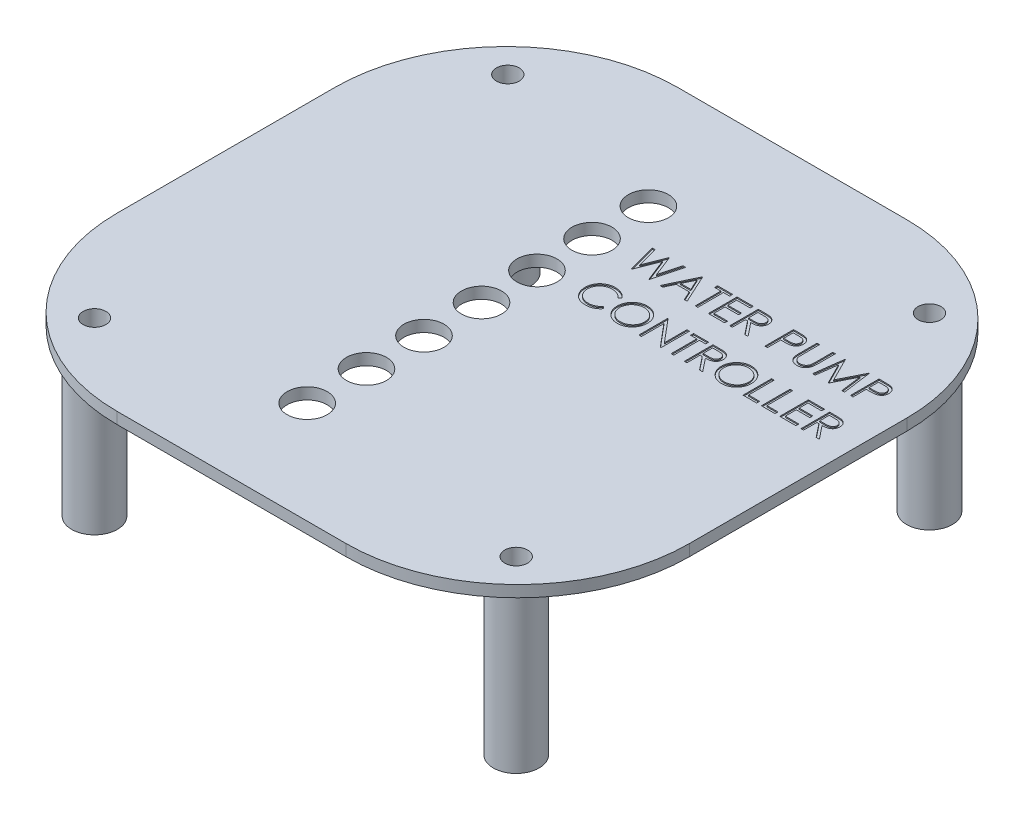
from build123d import *

# Parameters (mm, degrees)
SKETCH1_R                = 4
BOSS_EXTRUDE1_DEPTH      = 2
SKETCH5_R                = 3.5
CUT_EXTRUDE1_DEPTH       = 10
CUT_EXTRUDE2_DEPTH       = 0.2
BOSS_EXTRUDE2_DEPTH      = 2
BOSS_EXTRUDE2_DEPTH_BACK = 28
SKETCH1_6_R              = 4
SKETCH1_6_R_2            = 1.2
CUT_EXTRUDE3_DEPTH       = 3
CUT_EXTRUDE3_DEPTH_BACK  = 26
SKETCH1_7_R              = 2


with BuildPart() as part:
    # Sketch1 → Boss-Extrude1 (new body)
    with BuildSketch(Plane(origin=(0, 0, 0), x_dir=(1, 0, 0), z_dir=(0, 1, 0))):
        with BuildLine():
            Line((-20, -49), (20, -49))
            ThreePointArc((20, -49), (41.213203436, -40.213203436), (50, -19))
            Line((50, -19), (50, 19))
            ThreePointArc((50, 19), (41.213203436, 40.213203436), (20, 49))
            Line((20, 49), (-20, 49))
            ThreePointArc((-20, 49), (-41.213203436, 40.213203436), (-50, 19))
            Line((-50, 19), (-50, -19))
            ThreePointArc((-50, -19), (-41.213203436, -40.213203436), (-20, -49))
        make_face()
        with Locations(Location((-36.843325024, 36.106458524, 0), (0, 0, 270))):
            Circle(SKETCH1_R, mode=Mode.SUBTRACT)
        with Locations(Location((36.106458524, 36.843325024, 0), (0, 0, 270))):
            Circle(SKETCH1_R, mode=Mode.SUBTRACT)
        with Locations(Location((-36.106458524, -36.843325024, 0), (0, 0, 270))):
            Circle(SKETCH1_R, mode=Mode.SUBTRACT)
        with Locations(Location((36.843325024, -36.106458524, 0), (0, 0, 270))):
            Circle(SKETCH1_R, mode=Mode.SUBTRACT)
    extrude(amount=BOSS_EXTRUDE1_DEPTH)

    # Sketch5 → Cut-Extrude1 (cut)
    with BuildSketch(Plane(origin=(0, 0, 0), x_dir=(1, 0, 0), z_dir=(0, 1, 0))):
        with Locations(Location((-4.63917207, 28.478571343, 0), (0, 0, 270))):
            Circle(SKETCH5_R)
        with Locations(Location((-4.63917207, 18.621872332, 0), (0, 0, 270))):
            Circle(SKETCH5_R)
        with Locations(Location((-4.63917207, 9.004273886, 0), (0, 0, 270))):
            Circle(SKETCH5_R)
        with Locations(Location((-4.63917207, -0.687992807, 0), (0, 0, 270))):
            Circle(SKETCH5_R)
        with Locations(Location((-4.63917207, -10.737546261, 0), (0, 0, 270))):
            Circle(SKETCH5_R)
        with Locations(Location((-4.63917207, -20.789699287, 0), (0, 0, 270))):
            Circle(SKETCH5_R)
        with Locations(Location((-4.63917207, -31.146834905, 0), (0, 0, 270))):
            Circle(SKETCH5_R)
    extrude(amount=CUT_EXTRUDE1_DEPTH, mode=Mode.SUBTRACT)

    # Sketch7 → Cut-Extrude2 (cut)
    # profile 1 of 19: a face of its own
    with BuildSketch(Plane(origin=(0, 2, 0), x_dir=(1, 0, 0), z_dir=(0, 1, 0))):
        Polygon((2.04459951, 22.472075069), (2.508341497, 22.472075069), (3.486907202, 18.805208081), (4.942235728, 22.472075069), (5.007339894, 22.472075069), (6.435625151, 18.830248145), (7.419198869, 22.472075069), (7.877932843, 22.472075069), (6.529775792, 17.472075069), (6.465673228, 17.472075069), (4.961266176, 21.296193658), (3.438830279, 17.472075069), (3.374727715, 17.472075069), align=None)
    # profile 2 of 19: a face of its own
    with BuildSketch(Plane(origin=(0, 2, 0), x_dir=(1, 0, 0), z_dir=(0, 1, 0))):
        Polygon((10.826650792, 22.472075069), (13.134343099, 17.472075069), (12.646562651, 17.472075069), (11.907379958, 19.074639171), (9.640753356, 19.074639171), (8.88053701, 17.472075069), (8.390753356, 17.472075069), (10.762548228, 22.472075069), align=None)
        Polygon((10.789591497, 21.497515774), (9.884142779, 19.587459684), (11.671001753, 19.587459684), align=None, mode=Mode.SUBTRACT)
    # profile 3 of 19: a face of its own
    with BuildSketch(Plane(origin=(0, 2, 0), x_dir=(1, 0, 0), z_dir=(0, 1, 0))):
        Polygon((13.45485592, 21.959254556), (13.45485592, 22.472075069), (16.083061048, 22.472075069), (16.083061048, 21.959254556), (14.993317458, 21.959254556), (14.993317458, 17.472075069), (14.54459951, 17.472075069), (14.54459951, 21.959254556), align=None)
    # profile 4 of 19: a face of its own
    with BuildSketch(Plane(origin=(0, 2, 0), x_dir=(1, 0, 0), z_dir=(0, 1, 0))):
        Polygon((16.852291817, 22.472075069), (19.672804638, 22.472075069), (19.672804638, 21.959254556), (17.301009766, 21.959254556), (17.301009766, 20.420793017), (19.672804638, 20.420793017), (19.672804638, 19.907972504), (17.301009766, 19.907972504), (17.301009766, 17.984895581), (19.672804638, 17.984895581), (19.672804638, 17.472075069), (16.852291817, 17.472075069), align=None)
    # profile 5 of 19: a face of its own
    with BuildSketch(Plane(origin=(0, 2, 0), x_dir=(1, 0, 0), z_dir=(0, 1, 0))):
        with BuildLine():
            Line((20.570240535, 22.472075069), (21.570841497, 22.472075069))
            add(Edge.make_bspline(
                [(21.570841497, 22.472075069), (21.637614538, 22.471852803), (21.765826172, 22.471426028), (21.949502273, 22.469046367), (22.116398126, 22.462225859), (22.266426468, 22.456356454), (22.399584546, 22.44565368), (22.516280676, 22.435424184), (22.615977387, 22.42203324), (22.676328603, 22.409596922), (22.703653997, 22.403966094)],
                knots=[0, 0, 0, 0, 1.410062039, 2.707475311, 3.878576406, 4.937260626, 5.877586885, 6.699081471, 7.410979367, 8, 8, 8, 8], degree=3))
            add(Edge.make_bspline(
                [(22.703653997, 22.403966094), (22.740234888, 22.394927858), (22.812616302, 22.377044196), (22.916830682, 22.339244766), (23.016136859, 22.295502445), (23.110122322, 22.244125702), (23.19831631, 22.184733159), (23.281628182, 22.118350127), (23.360435987, 22.045339833), (23.431552602, 21.963861488), (23.49860839, 21.87838076), (23.555163571, 21.785946822), (23.603915685, 21.689287497), (23.642730709, 21.587419757), (23.673984957, 21.481331512), (23.696022441, 21.370061802), (23.709238424, 21.254117552), (23.710583932, 21.175034825), (23.711266176, 21.134935645)],
                knots=[0, 0, 0, 0, 1.027469482, 2.033020251, 3.019912614, 3.986113645, 4.951240523, 5.91722682, 6.890402269, 7.87763091, 8.8651537, 9.85103654, 10.82876324, 11.815024772, 12.821070561, 13.842952187, 14.906261191, 16, 16, 16, 16], degree=3))
            add(Edge.make_bspline(
                [(23.711266176, 21.134935645), (23.709167608, 21.068314067), (23.705072756, 20.938318113), (23.666894037, 20.749659711), (23.604356152, 20.573674976), (23.518180024, 20.410585493), (23.408437916, 20.263570286), (23.276545358, 20.134441064), (23.12242877, 20.026384046), (22.978958318, 19.951451468), (22.852223747, 19.903461598), (22.747890443, 19.869695371), (22.634080476, 19.843606849), (22.511884283, 19.820235233), (22.380793347, 19.802589955), (22.241121862, 19.789666249), (22.092770217, 19.781589036), (21.990857261, 19.780386172), (21.938429638, 19.779767376)],
                knots=[0, 0, 0, 0, 1.260483769, 2.459530307, 3.627416485, 4.787058657, 5.939039949, 7.08810263, 8.267026773, 9.491475466, 10.141966685, 10.831826277, 11.566392101, 12.351337768, 13.187381173, 14.07005841, 15.007169909, 16, 16, 16, 16], degree=3))
            Line((21.938429638, 19.779767376), (23.77536874, 17.472075069))
            Line((23.77536874, 17.472075069), (23.22048092, 17.472075069))
            Line((23.22048092, 17.472075069), (21.383541817, 19.779767376))
            Line((21.383541817, 19.779767376), (21.018958484, 19.779767376))
            Line((21.018958484, 19.779767376), (21.018958484, 17.472075069))
            Line((21.018958484, 17.472075069), (20.570240535, 17.472075069))
            Line((20.570240535, 17.472075069), (20.570240535, 22.472075069))
        make_face()
        with BuildLine():
            Line((21.018958484, 21.959254556), (21.018958484, 20.292587889))
            Line((21.018958484, 20.292587889), (21.934423228, 20.285576671))
            add(Edge.make_bspline(
                [(21.934423228, 20.285576671), (21.97716614, 20.285557762), (22.060014079, 20.28552111), (22.179872172, 20.291226504), (22.291472331, 20.297716959), (22.394387691, 20.307644595), (22.488664228, 20.320438983), (22.574254818, 20.336443247), (22.651299178, 20.35508905), (22.741154233, 20.383948516), (22.841492135, 20.429671399), (22.950537077, 20.49619354), (23.04339756, 20.57986371), (23.121851649, 20.675540076), (23.184893694, 20.780734717), (23.229339486, 20.894186673), (23.257542975, 21.013031813), (23.260869468, 21.094714825), (23.262548228, 21.135937248)],
                knots=[0, 0, 0, 0, 1.146690395, 2.22261258, 3.21895312, 4.145990853, 4.996080663, 5.770904154, 6.481378293, 7.121626537, 8.300444488, 9.431385265, 10.535395872, 11.636531494, 12.74115979, 13.810798291, 14.895190096, 16, 16, 16, 16], degree=3))
            add(Edge.make_bspline(
                [(23.262548228, 21.135937248), (23.260830912, 21.176146639), (23.257427818, 21.25582698), (23.229643863, 21.37247828), (23.182659033, 21.482573923), (23.11934155, 21.585666045), (23.0421999, 21.679245668), (22.951745882, 21.759313029), (22.850452746, 21.825383693), (22.755779606, 21.867604236), (22.671159302, 21.893489741), (22.597688359, 21.911705689), (22.514671962, 21.926340645), (22.421707021, 21.938066446), (22.319190406, 21.948144938), (22.206603762, 21.954933193), (22.084694076, 21.958952999), (22.00019846, 21.959151698), (21.956458484, 21.959254556)],
                knots=[0, 0, 0, 0, 1.101028733, 2.181837193, 3.264309656, 4.369019818, 5.486613113, 6.575447106, 7.666700264, 8.788928104, 9.402425223, 10.0903467, 10.862060571, 11.710948788, 12.657782767, 13.684531032, 14.801375019, 16, 16, 16, 16], degree=3))
            Line((21.956458484, 21.959254556), (21.018958484, 21.959254556))
        make_face(mode=Mode.SUBTRACT)
    # profile 6 of 19: a face of its own
    with BuildSketch(Plane(origin=(0, 2, 0), x_dir=(1, 0, 0), z_dir=(0, 1, 0))):
        with BuildLine():
            Line((26.724086689, 22.472075069), (27.704655599, 22.472075069))
            add(Edge.make_bspline(
                [(27.704655599, 22.472075069), (27.772099751, 22.472000931), (27.901325741, 22.47185888), (28.086632963, 22.467552101), (28.25493258, 22.461799683), (28.405861695, 22.45382555), (28.539884693, 22.44440185), (28.656395121, 22.431184651), (28.756308773, 22.417384228), (28.816175129, 22.403353648), (28.843477715, 22.396954876)],
                knots=[0, 0, 0, 0, 1.415646017, 2.712440637, 3.8905458, 4.950247383, 5.884950622, 6.709939814, 7.411656543, 8, 8, 8, 8], degree=3))
            add(Edge.make_bspline(
                [(28.843477715, 22.396954876), (28.878039906, 22.387494948), (28.946349873, 22.368798003), (29.044779935, 22.331349826), (29.138428286, 22.286946733), (29.227616226, 22.236341105), (29.311247773, 22.177361727), (29.390570689, 22.112399416), (29.464884947, 22.039954318), (29.533772649, 21.960838976), (29.597036646, 21.876381533), (29.651507621, 21.785321205), (29.697117946, 21.689190771), (29.736236905, 21.588057098), (29.76439184, 21.481070922), (29.785601697, 21.368975618), (29.799064022, 21.251783204), (29.800353396, 21.171697679), (29.801009766, 21.130929235)],
                knots=[0, 0, 0, 0, 0.999701418, 1.975846123, 2.934577507, 3.890451536, 4.834027766, 5.787354733, 6.749476667, 7.726910423, 8.712836071, 9.690891519, 10.682875813, 11.679750201, 12.712814741, 13.765529915, 14.8625177, 16, 16, 16, 16], degree=3))
            add(Edge.make_bspline(
                [(29.801009766, 21.130929235), (29.800407731, 21.089818125), (29.799229808, 21.009381463), (29.785092257, 20.891706051), (29.766049127, 20.779251208), (29.736767623, 20.672266279), (29.698416662, 20.571386607), (29.653428015, 20.475070561), (29.599165829, 20.384956744), (29.536816072, 20.300718005), (29.467456651, 20.222275273), (29.391381025, 20.150196995), (29.308896322, 20.084905083), (29.220264682, 20.026253163), (29.12462204, 19.975601335), (29.023418964, 19.930233757), (28.915775798, 19.892132242), (28.841286492, 19.872089297), (28.803413612, 19.861898786)],
                knots=[0, 0, 0, 0, 1.121902311, 2.195077645, 3.232258892, 4.234102512, 5.217864754, 6.176164875, 7.132989551, 8.084763148, 9.034132444, 9.988522005, 10.94243251, 11.903244335, 12.886203696, 13.894208494, 14.929344452, 16, 16, 16, 16], degree=3))
            add(Edge.make_bspline(
                [(28.803413612, 19.861898786), (28.772088849, 19.855237385), (28.70343881, 19.840638536), (28.590377779, 19.824340741), (28.458741513, 19.810429883), (28.308709685, 19.799999686), (28.140416963, 19.791070588), (27.95377231, 19.783973311), (27.748409342, 19.78007352), (27.605164708, 19.779872387), (27.530376753, 19.779767376)],
                knots=[0, 0, 0, 0, 0.601384939, 1.31797006, 2.144135048, 3.087295005, 4.142315834, 5.309527816, 6.595305764, 8, 8, 8, 8], degree=3))
            Line((27.530376753, 19.779767376), (27.172804638, 19.779767376))
            Line((27.172804638, 19.779767376), (27.172804638, 17.472075069))
            Line((27.172804638, 17.472075069), (26.724086689, 17.472075069))
            Line((26.724086689, 17.472075069), (26.724086689, 22.472075069))
        make_face()
        with BuildLine():
            Line((27.172804638, 21.959254556), (27.172804638, 20.292587889))
            Line((27.172804638, 20.292587889), (28.048205279, 20.281570261))
            add(Edge.make_bspline(
                [(28.048205279, 20.281570261), (28.09094803, 20.28154817), (28.17346203, 20.281505524), (28.292656635, 20.2871987), (28.403241331, 20.29377089), (28.504876438, 20.303393638), (28.597607773, 20.316995434), (28.681589957, 20.330726488), (28.75617179, 20.350591292), (28.843456364, 20.377338534), (28.940718289, 20.422956556), (29.046529073, 20.489170685), (29.136201339, 20.573571696), (29.213798906, 20.668468598), (29.275378731, 20.774038783), (29.32045872, 20.886994407), (29.346946088, 21.006177049), (29.350497793, 21.087731533), (29.352291817, 21.12892603)],
                knots=[0, 0, 0, 0, 1.160613943, 2.240541288, 3.23993089, 4.169200891, 5.011653406, 5.7853311, 6.478053781, 7.106038997, 8.262395093, 9.384106736, 10.481365981, 11.59014053, 12.70357646, 13.786202915, 14.881775077, 16, 16, 16, 16], degree=3))
            add(Edge.make_bspline(
                [(29.352291817, 21.12892603), (29.350488037, 21.169123906), (29.346902344, 21.249032309), (29.320251111, 21.366144825), (29.275466377, 21.477910117), (29.213385527, 21.582157381), (29.138041056, 21.676712816), (29.050470566, 21.758851569), (28.950880192, 21.824882572), (28.858239862, 21.867501546), (28.775952454, 21.893523368), (28.704478225, 21.911730283), (28.623777262, 21.926266864), (28.533823291, 21.938037582), (28.435313528, 21.948113955), (28.32740165, 21.954951065), (28.210496445, 21.958953146), (28.129338487, 21.959151653), (28.087267779, 21.959254556)],
                knots=[0, 0, 0, 0, 1.120700087, 2.227813068, 3.331159281, 4.466773991, 5.599788987, 6.693661531, 7.80175334, 8.91857717, 9.525282508, 10.207424825, 10.974604443, 11.810962634, 12.737642355, 13.736264703, 14.826523623, 16, 16, 16, 16], degree=3))
            Line((28.087267779, 21.959254556), (27.172804638, 21.959254556))
        make_face(mode=Mode.SUBTRACT)
    # profile 7 of 19: a face of its own
    with BuildSketch(Plane(origin=(0, 2, 0), x_dir=(1, 0, 0), z_dir=(0, 1, 0))):
        with BuildLine():
            Line((30.826650792, 22.472075069), (31.27536874, 22.472075069))
            Line((31.27536874, 22.472075069), (31.27536874, 19.476281799))
            add(Edge.make_bspline(
                [(31.27536874, 19.476281799), (31.275301963, 19.433880748), (31.275175242, 19.353417447), (31.276021691, 19.238891303), (31.278392217, 19.137073505), (31.279886731, 19.047571579), (31.283211493, 18.970796226), (31.285922988, 18.906331496), (31.289409498, 18.854482636), (31.293599666, 18.82422417), (31.295400792, 18.811217697)],
                knots=[0, 0, 0, 0, 1.528628734, 2.90083645, 4.128790002, 5.200304208, 6.127813768, 6.898992206, 7.526736466, 8, 8, 8, 8], degree=3))
            add(Edge.make_bspline(
                [(31.295400792, 18.811217697), (31.302797161, 18.764293749), (31.317173142, 18.67308985), (31.353810824, 18.543220876), (31.404978683, 18.426175936), (31.465611601, 18.318302663), (31.545515332, 18.222603577), (31.641234668, 18.134444073), (31.757202909, 18.057341495), (31.886146631, 17.986840335), (32.025125542, 17.930175932), (32.167141636, 17.887328269), (32.310060178, 17.861215555), (32.405740414, 17.858191927), (32.453253356, 17.856690453)],
                knots=[0, 0, 0, 0, 1.035780045, 2.013197591, 2.933192213, 3.817615948, 4.702609284, 5.640816605, 6.646850145, 7.73207398, 8.84249596, 9.914020372, 10.964143139, 12, 12, 12, 12], degree=3))
            add(Edge.make_bspline(
                [(32.453253356, 17.856690453), (32.494044413, 17.858224525), (32.57539093, 17.861283808), (32.69625726, 17.88022871), (32.813971701, 17.914372375), (32.929115529, 17.958429173), (33.037045507, 18.016640017), (33.137821853, 18.083884073), (33.22777033, 18.162756754), (33.309853184, 18.25004296), (33.381331664, 18.348528389), (33.443290438, 18.456068586), (33.494041766, 18.574281938), (33.519103944, 18.657359684), (33.531979317, 18.700039812)],
                knots=[0, 0, 0, 0, 0.994687771, 1.983630487, 2.973142513, 3.978332533, 4.983357753, 5.956394766, 6.925816176, 7.893390482, 8.871859704, 9.88551698, 10.913711441, 12, 12, 12, 12], degree=3))
            add(Edge.make_bspline(
                [(33.531979317, 18.700039812), (33.536265211, 18.717680633), (33.545815908, 18.75699149), (33.554740258, 18.823450476), (33.564035294, 18.901863853), (33.57048468, 18.992795015), (33.576772138, 19.095939261), (33.58053367, 19.211833915), (33.582272289, 19.340058144), (33.582790404, 19.429539804), (33.583061048, 19.476281799)],
                knots=[0, 0, 0, 0, 0.558680831, 1.244966039, 2.062412453, 2.990489873, 4.051219941, 5.244515665, 6.560634259, 8, 8, 8, 8], degree=3))
            Line((33.583061048, 19.476281799), (33.583061048, 22.472075069))
            Line((33.583061048, 22.472075069), (34.031778997, 22.472075069))
            Line((34.031778997, 22.472075069), (34.031778997, 19.452243338))
            add(Edge.make_bspline(
                [(34.031778997, 19.452243338), (34.031415968, 19.397817082), (34.030707494, 19.291600935), (34.024563814, 19.135956136), (34.0147681, 18.98830902), (34.000927974, 18.84863974), (33.982589398, 18.717448084), (33.962196226, 18.593584129), (33.936225464, 18.477936997), (33.905892034, 18.369604971), (33.871215537, 18.266482809), (33.826299611, 18.16861336), (33.775693182, 18.07302136), (33.715672249, 17.981152633), (33.648227417, 17.892600415), (33.571867873, 17.807901736), (33.489119072, 17.725703099), (33.398605415, 17.648113004), (33.301818951, 17.576957751), (33.199047582, 17.514389507), (33.091080769, 17.461498625), (32.97819916, 17.41796159), (32.860354584, 17.385226448), (32.73754407, 17.360833369), (32.60948808, 17.346972944), (32.522395714, 17.344913043), (32.47829342, 17.34386994)],
                knots=[0, 0, 0, 0, 1.316592851, 2.569410997, 3.76748051, 4.895814652, 5.963796859, 6.97159953, 7.931736103, 8.829262218, 9.692595152, 10.560224239, 11.431080259, 12.30701507, 13.211635791, 14.121146779, 15.063487852, 16.031507147, 17.00238618, 17.966455255, 18.938106653, 19.907068911, 20.888905087, 21.893141452, 22.933117798, 24, 24, 24, 24], degree=3))
            add(Edge.make_bspline(
                [(32.47829342, 17.34386994), (32.430194702, 17.344991034), (32.335825189, 17.347190614), (32.196770807, 17.359794543), (32.063464813, 17.383535107), (31.934499274, 17.413763598), (31.811629992, 17.455454651), (31.693210786, 17.504166258), (31.581269813, 17.563990915), (31.473991058, 17.630552905), (31.374241406, 17.705445246), (31.282673688, 17.787074065), (31.19913673, 17.874131747), (31.125038592, 17.967560841), (31.059151614, 18.066634709), (31.002394166, 18.171633623), (30.95366096, 18.282516931), (30.928508722, 18.359592932), (30.91579342, 18.39855744)],
                knots=[0, 0, 0, 0, 1.13879206, 2.234305948, 3.301075583, 4.341971843, 5.366689343, 6.369221514, 7.369726634, 8.367512178, 9.355451585, 10.318319045, 11.268648973, 12.207971039, 13.137398894, 14.081662264, 15.030215811, 16, 16, 16, 16], degree=3))
            add(Edge.make_bspline(
                [(30.91579342, 18.39855744), (30.90839748, 18.425175404), (30.892355521, 18.482910359), (30.875176524, 18.578462486), (30.860734979, 18.688483797), (30.84715561, 18.812981823), (30.839142813, 18.952053061), (30.8321179, 19.105637227), (30.826601302, 19.273920029), (30.826633834, 19.391140766), (30.826650792, 19.452243338)],
                knots=[0, 0, 0, 0, 0.625038921, 1.35572334, 2.194682327, 3.136881307, 4.189498639, 5.346923369, 6.617055217, 8, 8, 8, 8], degree=3))
            Line((30.826650792, 19.452243338), (30.826650792, 22.472075069))
        make_face()
    # profile 8 of 19: a face of its own
    with BuildSketch(Plane(origin=(0, 2, 0), x_dir=(1, 0, 0), z_dir=(0, 1, 0))):
        Polygon((35.057420022, 17.472075069), (35.717476112, 22.472075069), (35.781578676, 22.472075069), (37.845881561, 18.369510966), (39.905176433, 22.472075069), (39.970280599, 22.472075069), (40.634343099, 17.472075069), (40.183621946, 17.472075069), (39.70485592, 21.069831479), (37.899968099, 17.472075069), (37.79880624, 17.472075069), (35.986907202, 21.077844299), (35.509142779, 17.472075069), align=None)
    # profile 9 of 19: a face of its own
    with BuildSketch(Plane(origin=(0, 2, 0), x_dir=(1, 0, 0), z_dir=(0, 1, 0))):
        with BuildLine():
            Line((41.659984125, 22.472075069), (42.640553035, 22.472075069))
            add(Edge.make_bspline(
                [(42.640553035, 22.472075069), (42.707997187, 22.472000931), (42.837223177, 22.47185888), (43.022530399, 22.467552101), (43.190830016, 22.461799683), (43.341759131, 22.45382555), (43.475782129, 22.44440185), (43.592292557, 22.431184651), (43.692206208, 22.417384228), (43.752072565, 22.403353648), (43.779375151, 22.396954876)],
                knots=[0, 0, 0, 0, 1.415646017, 2.712440637, 3.8905458, 4.950247383, 5.884950622, 6.709939814, 7.411656543, 8, 8, 8, 8], degree=3))
            add(Edge.make_bspline(
                [(43.779375151, 22.396954876), (43.813937342, 22.387494948), (43.882247309, 22.368798003), (43.980677371, 22.331349826), (44.074325721, 22.286946733), (44.163513662, 22.236341105), (44.247145209, 22.177361727), (44.326468125, 22.112399416), (44.400782383, 22.039954318), (44.469670085, 21.960838976), (44.532934082, 21.876381533), (44.587405057, 21.785321205), (44.633015381, 21.689190771), (44.672134341, 21.588057098), (44.700289276, 21.481070922), (44.721499132, 21.368975618), (44.734961458, 21.251783204), (44.736250832, 21.171697679), (44.736907202, 21.130929235)],
                knots=[0, 0, 0, 0, 0.999701418, 1.975846123, 2.934577507, 3.890451536, 4.834027766, 5.787354733, 6.749476667, 7.726910423, 8.712836071, 9.690891519, 10.682875813, 11.679750201, 12.712814741, 13.765529915, 14.8625177, 16, 16, 16, 16], degree=3))
            add(Edge.make_bspline(
                [(44.736907202, 21.130929235), (44.736305167, 21.089818125), (44.735127244, 21.009381463), (44.720989693, 20.891706051), (44.701946562, 20.779251208), (44.672665059, 20.672266279), (44.634314098, 20.571386607), (44.589325451, 20.475070561), (44.535063264, 20.384956744), (44.472713508, 20.300718005), (44.403354087, 20.222275273), (44.327278461, 20.150196995), (44.244793758, 20.084905083), (44.156162118, 20.026253163), (44.060519476, 19.975601335), (43.9593164, 19.930233757), (43.851673233, 19.892132242), (43.777183928, 19.872089297), (43.739311048, 19.861898786)],
                knots=[0, 0, 0, 0, 1.121902311, 2.195077645, 3.232258892, 4.234102512, 5.217864754, 6.176164875, 7.132989551, 8.084763148, 9.034132444, 9.988522005, 10.94243251, 11.903244335, 12.886203696, 13.894208494, 14.929344452, 16, 16, 16, 16], degree=3))
            add(Edge.make_bspline(
                [(43.739311048, 19.861898786), (43.707986285, 19.855237385), (43.639336246, 19.840638536), (43.526275214, 19.824340741), (43.394638949, 19.810429883), (43.24460712, 19.799999686), (43.076314399, 19.791070588), (42.889669746, 19.783973311), (42.684306778, 19.78007352), (42.541062144, 19.779872387), (42.466274189, 19.779767376)],
                knots=[0, 0, 0, 0, 0.601384939, 1.31797006, 2.144135048, 3.087295005, 4.142315834, 5.309527816, 6.595305764, 8, 8, 8, 8], degree=3))
            Line((42.466274189, 19.779767376), (42.108702074, 19.779767376))
            Line((42.108702074, 19.779767376), (42.108702074, 17.472075069))
            Line((42.108702074, 17.472075069), (41.659984125, 17.472075069))
            Line((41.659984125, 17.472075069), (41.659984125, 22.472075069))
        make_face()
        with BuildLine():
            Line((42.108702074, 21.959254556), (42.108702074, 20.292587889))
            Line((42.108702074, 20.292587889), (42.984102715, 20.281570261))
            add(Edge.make_bspline(
                [(42.984102715, 20.281570261), (43.026845466, 20.28154817), (43.109359466, 20.281505524), (43.22855407, 20.2871987), (43.339138767, 20.29377089), (43.440773874, 20.303393638), (43.533505209, 20.316995434), (43.617487393, 20.330726488), (43.692069226, 20.350591292), (43.7793538, 20.377338534), (43.876615725, 20.422956556), (43.982426509, 20.489170685), (44.072098775, 20.573571696), (44.149696342, 20.668468598), (44.211276167, 20.774038783), (44.256356156, 20.886994407), (44.282843524, 21.006177049), (44.286395229, 21.087731533), (44.288189253, 21.12892603)],
                knots=[0, 0, 0, 0, 1.160613943, 2.240541288, 3.23993089, 4.169200891, 5.011653406, 5.7853311, 6.478053781, 7.106038997, 8.262395093, 9.384106736, 10.481365981, 11.59014053, 12.70357646, 13.786202915, 14.881775077, 16, 16, 16, 16], degree=3))
            add(Edge.make_bspline(
                [(44.288189253, 21.12892603), (44.286385473, 21.169123906), (44.28279978, 21.249032309), (44.256148547, 21.366144825), (44.211363813, 21.477910117), (44.149282963, 21.582157381), (44.073938492, 21.676712816), (43.986368002, 21.758851569), (43.886777628, 21.824882572), (43.794137298, 21.867501546), (43.71184989, 21.893523368), (43.640375661, 21.911730283), (43.559674698, 21.926266864), (43.469720727, 21.938037582), (43.371210964, 21.948113955), (43.263299086, 21.954951065), (43.146393881, 21.958953146), (43.065235923, 21.959151653), (43.023165215, 21.959254556)],
                knots=[0, 0, 0, 0, 1.120700087, 2.227813068, 3.331159281, 4.466773991, 5.599788987, 6.693661531, 7.80175334, 8.91857717, 9.525282508, 10.207424825, 10.974604443, 11.810962634, 12.737642355, 13.736264703, 14.826523623, 16, 16, 16, 16], degree=3))
            Line((43.023165215, 21.959254556), (42.108702074, 21.959254556))
        make_face(mode=Mode.SUBTRACT)
    # profile 10 of 19: a face of its own
    with BuildSketch(Plane(origin=(0, 2, 0), x_dir=(1, 0, 0), z_dir=(0, 1, 0))):
        with BuildLine():
            Line((6.980496946, 12.221273786), (6.58786874, 11.920793017))
            add(Edge.make_bspline(
                [(6.58786874, 11.920793017), (6.559860328, 11.954172974), (6.504221119, 12.020482854), (6.414707972, 12.113596489), (6.321419911, 12.200832576), (6.224392595, 12.28260669), (6.121879567, 12.356059213), (6.01636414, 12.425017931), (5.906081219, 12.486828985), (5.753578741, 12.561776108), (5.554081815, 12.639984901), (5.30294633, 12.705560946), (5.040787618, 12.747305483), (4.861933904, 12.751826685), (4.770961689, 12.754126351)],
                knots=[0, 0, 0, 0, 0.757959112, 1.505699292, 2.245454638, 2.979532153, 3.711538275, 4.438200793, 5.171680507, 5.909471876, 7.393775596, 8.890124382, 10.418191784, 12, 12, 12, 12], degree=3))
            add(Edge.make_bspline(
                [(4.770961689, 12.754126351), (4.72084269, 12.753549261), (4.621069844, 12.752400439), (4.473000596, 12.737244545), (4.327696237, 12.715942817), (4.185251285, 12.684335212), (4.045847059, 12.644374328), (3.908572199, 12.596623736), (3.775414199, 12.537545394), (3.644531001, 12.47224788), (3.519132129, 12.398494387), (3.40048206, 12.318046742), (3.289013535, 12.231805175), (3.184638375, 12.139446452), (3.087249877, 12.041386508), (2.997553719, 11.936580306), (2.915860275, 11.825362915), (2.84055024, 11.709200904), (2.773103478, 11.588432631), (2.716632221, 11.462611102), (2.666624904, 11.333890954), (2.627054557, 11.200817867), (2.595733819, 11.064328202), (2.574122871, 10.924055648), (2.559139341, 10.780293248), (2.557996231, 10.682851373), (2.557420022, 10.633733722)],
                knots=[0, 0, 0, 0, 1.054917814, 2.100044995, 3.131103042, 4.146048494, 5.169673617, 6.183595914, 7.203665975, 8.234915748, 9.262203917, 10.264457458, 11.251630812, 12.227803204, 13.197192746, 14.159520551, 15.12972552, 16.100847026, 17.073214652, 18.039054194, 19.002613845, 19.979014051, 20.95965708, 21.949030935, 22.966165397, 24, 24, 24, 24], degree=3))
            add(Edge.make_bspline(
                [(2.557420022, 10.633733722), (2.559222621, 10.559831837), (2.562761784, 10.414735287), (2.594259404, 10.202205843), (2.642123821, 9.998604881), (2.713860359, 9.805205106), (2.802316146, 9.619621737), (2.914088448, 9.444994804), (3.043540644, 9.278685426), (3.1925041, 9.124624072), (3.35594098, 8.983890179), (3.53129514, 8.859960777), (3.718129837, 8.756653802), (3.914382165, 8.670688164), (4.121562328, 8.604607124), (4.33929776, 8.558086948), (4.567114896, 8.527740976), (4.722785467, 8.524835707), (4.802011369, 8.52335712)],
                knots=[0, 0, 0, 0, 1.029171465, 2.020641659, 2.987623507, 3.938342917, 4.889210282, 5.84687017, 6.821220943, 7.821438502, 8.827599549, 9.822697543, 10.807740252, 11.797342354, 12.80366471, 13.83203677, 14.896651826, 16, 16, 16, 16], degree=3))
            add(Edge.make_bspline(
                [(4.802011369, 8.52335712), (4.889300924, 8.525769662), (5.061107651, 8.530518123), (5.313061975, 8.570745622), (5.554255926, 8.635971219), (5.784702478, 8.727253965), (6.003751972, 8.845918662), (6.211747201, 8.989772772), (6.408863731, 9.160184676), (6.527394134, 9.290303431), (6.58786874, 9.356690453)],
                knots=[0, 0, 0, 0, 1.028121516, 2.023589091, 2.998037872, 3.967518031, 4.937445131, 5.927275754, 6.942489185, 8, 8, 8, 8], degree=3))
            Line((6.58786874, 9.356690453), (6.980496946, 9.059214492))
            add(Edge.make_bspline(
                [(6.980496946, 9.059214492), (6.948899646, 9.018445275), (6.885856395, 8.937102123), (6.783773514, 8.822428252), (6.676234518, 8.714565344), (6.562440646, 8.614383028), (6.443700944, 8.519876648), (6.317883355, 8.433731175), (6.18664188, 8.354744198), (6.050421196, 8.28242002), (5.909366035, 8.218252524), (5.763645413, 8.16331857), (5.613887448, 8.115997299), (5.460085293, 8.077065961), (5.301919926, 8.046678698), (5.139962106, 8.026364877), (4.973862285, 8.012447857), (4.861803112, 8.011179405), (4.805016176, 8.010536607)],
                knots=[0, 0, 0, 0, 0.986787822, 1.968848986, 2.935600012, 3.899624008, 4.868462664, 5.837806735, 6.815139263, 7.798259679, 8.787526145, 9.778297419, 10.776456485, 11.791383307, 12.812564526, 13.85620153, 14.913611965, 16, 16, 16, 16], degree=3))
            add(Edge.make_bspline(
                [(4.805016176, 8.010536607), (4.751239509, 8.010910882), (4.644902809, 8.011650965), (4.487904592, 8.023639775), (4.335062334, 8.039996542), (4.186812869, 8.064625301), (4.04234719, 8.093688644), (3.902974926, 8.132647582), (3.767324626, 8.176289248), (3.635941282, 8.227582087), (3.508713139, 8.285462347), (3.386050552, 8.35087886), (3.268009934, 8.423281524), (3.153430761, 8.501074396), (3.044005642, 8.586756256), (2.93878632, 8.679137162), (2.837182782, 8.777905749), (2.774321804, 8.849126968), (2.742716497, 8.884935645)],
                knots=[0, 0, 0, 0, 1.114604814, 2.203992996, 3.262667896, 4.300477797, 5.318619304, 6.316056647, 7.298880507, 8.271930387, 9.238335007, 10.195173496, 11.151986948, 12.108099108, 13.064862484, 14.031167946, 15.010108607, 16, 16, 16, 16], degree=3))
            add(Edge.make_bspline(
                [(2.742716497, 8.884935645), (2.692094149, 8.947137344), (2.591460611, 9.070789787), (2.462709634, 9.271198332), (2.352498841, 9.48043863), (2.263390383, 9.699609957), (2.193729335, 9.92822051), (2.145470485, 10.166385531), (2.11411105, 10.413882591), (2.110524923, 10.582220861), (2.108702074, 10.66778821)],
                knots=[0, 0, 0, 0, 0.994628077, 1.977248131, 2.950237994, 3.925870899, 4.908910175, 5.911660606, 6.938484602, 8, 8, 8, 8], degree=3))
            add(Edge.make_bspline(
                [(2.108702074, 10.66778821), (2.110923779, 10.757724572), (2.115294845, 10.93466875), (2.152431696, 11.194345826), (2.212172833, 11.443133538), (2.297025531, 11.680567459), (2.404604604, 11.907896431), (2.537499767, 12.123383867), (2.694167113, 12.328407866), (2.873377924, 12.519857511), (3.069902689, 12.694913729), (3.280358137, 12.848922591), (3.504332347, 12.977090471), (3.739357849, 13.084227846), (3.987194537, 13.166577079), (4.247313636, 13.224224489), (4.519226371, 13.260106083), (4.704744122, 13.264642095), (4.799006561, 13.266946863)],
                knots=[0, 0, 0, 0, 1.032925535, 2.032216505, 3.007276963, 3.968222605, 4.92396291, 5.891752235, 6.871517503, 7.883894988, 8.900124299, 9.891468569, 10.874487609, 11.85992873, 12.854644235, 13.869047385, 14.917252991, 16, 16, 16, 16], degree=3))
            add(Edge.make_bspline(
                [(4.799006561, 13.266946863), (4.856455807, 13.266258095), (4.970170803, 13.264894746), (5.138388878, 13.251600257), (5.30216363, 13.229437963), (5.46160789, 13.199272149), (5.617497342, 13.161833118), (5.768640543, 13.113061263), (5.915924382, 13.05729479), (6.058419965, 12.99306841), (6.195443608, 12.920973065), (6.326952634, 12.841807889), (6.451902433, 12.755671024), (6.571172216, 12.663295059), (6.682766803, 12.562725688), (6.78985463, 12.456729123), (6.888799027, 12.342252231), (6.94987502, 12.261673754), (6.980496946, 12.221273786)],
                knots=[0, 0, 0, 0, 1.096760587, 2.17092713, 3.219439832, 4.250915756, 5.268269357, 6.278326846, 7.281116186, 8.274029601, 9.260640565, 10.235837813, 11.203064059, 12.156899882, 13.114053108, 14.069676657, 15.032185724, 16, 16, 16, 16], degree=3))
        make_face()
    # profile 11 of 19: a face of its own
    with BuildSketch(Plane(origin=(0, 2, 0), x_dir=(1, 0, 0), z_dir=(0, 1, 0))):
        with BuildLine():
            add(Edge.make_bspline(
                [(10.345881561, 13.266946863), (10.438464569, 13.264601893), (10.620305236, 13.259996177), (10.88755509, 13.224740315), (11.142690941, 13.163746901), (11.387791139, 13.082514069), (11.619923963, 12.974150661), (11.840836666, 12.843171878), (12.050003629, 12.688205508), (12.244605602, 12.51044947), (12.42268696, 12.317044535), (12.579581083, 12.110647521), (12.711070074, 11.892506375), (12.81904977, 11.663276617), (12.90376207, 11.423476663), (12.962217847, 11.171828087), (12.999558061, 10.909961387), (13.003923457, 10.73135158), (13.006137971, 10.64074494)],
                knots=[0, 0, 0, 0, 1.065120563, 2.091984664, 3.0946048, 4.079830382, 5.057816894, 6.036188127, 7.030412546, 8.04752943, 9.064399622, 10.05169764, 11.02544977, 11.989514704, 12.962713494, 13.945757189, 14.957906945, 16, 16, 16, 16], degree=3))
            add(Edge.make_bspline(
                [(13.006137971, 10.64074494), (13.003923782, 10.550805731), (12.999559358, 10.373525131), (12.96217539, 10.11332021), (12.90354539, 9.863190644), (12.819836439, 9.623553997), (12.712371469, 9.394157477), (12.580006939, 9.175604686), (12.424090924, 8.967823974), (12.246652565, 8.773091595), (12.053222505, 8.59452378), (11.845750695, 8.438925386), (11.628903096, 8.30503378), (11.399889227, 8.19819996), (11.161746317, 8.112811502), (10.912342998, 8.054593459), (10.652847921, 8.01704054), (10.475889344, 8.012728374), (10.385945663, 8.010536607)],
                knots=[0, 0, 0, 0, 1.043624062, 2.057103931, 3.04512605, 4.022047818, 4.998200453, 5.980619268, 6.982898556, 8.009068085, 9.034988726, 10.034168286, 11.015286542, 11.987931943, 12.962482838, 13.94673481, 14.956375938, 16, 16, 16, 16], degree=3))
            add(Edge.make_bspline(
                [(10.385945663, 8.010536607), (10.295339494, 8.012750017), (10.116730614, 8.017113237), (9.854534849, 8.054515244), (9.6027095, 8.11300282), (9.361974713, 8.196587729), (9.132196242, 8.304612345), (8.912924695, 8.436332886), (8.705040199, 8.592628802), (8.510266276, 8.770009623), (8.332053136, 8.96311184), (8.176682599, 9.170017919), (8.044932437, 9.386668571), (7.937270533, 9.613665034), (7.852035591, 9.849909952), (7.793885851, 10.096979206), (7.756263063, 10.353464214), (7.751927568, 10.528096926), (7.749727715, 10.616706479)],
                knots=[0, 0, 0, 0, 1.053102029, 2.075944431, 3.073151272, 4.055350789, 5.033113405, 6.020478099, 7.024410459, 8.052272461, 9.079885166, 10.07527673, 11.055994387, 12.023226415, 12.992069828, 13.970394897, 14.97016774, 16, 16, 16, 16], degree=3))
            add(Edge.make_bspline(
                [(7.749727715, 10.616706479), (7.75049148, 10.67618172), (7.752009375, 10.794381897), (7.770283221, 10.969905611), (7.796799937, 11.142606551), (7.834802669, 11.31199362), (7.884505051, 11.477652169), (7.943150804, 11.640724687), (8.014779154, 11.799558578), (8.095751509, 11.954906281), (8.18612552, 12.104346146), (8.28594802, 12.245602694), (8.391712832, 12.379861261), (8.507660537, 12.503642695), (8.629969744, 12.620547918), (8.76062457, 12.728780371), (8.898827776, 12.829316015), (9.045174033, 12.919916502), (9.196057283, 13.001858123), (9.351595537, 13.072175053), (9.509676353, 13.13252657), (9.671040136, 13.181442034), (9.835258382, 13.220059229), (10.002689503, 13.246355448), (10.173200112, 13.264675902), (10.288073425, 13.266186619), (10.345881561, 13.266946863)],
                knots=[0, 0, 0, 0, 1.037015668, 2.060948919, 3.074880161, 4.083647147, 5.086022904, 6.090072063, 7.104153813, 8.122640571, 9.144368836, 10.147691507, 11.138137339, 12.123020368, 13.103399296, 14.087645067, 15.080126199, 16.082011238, 17.087798457, 18.072939717, 19.057185487, 20.037253025, 21.01195951, 21.997135196, 22.992090687, 24, 24, 24, 24], degree=3))
        make_face()
        with BuildLine():
            add(Edge.make_bspline(
                [(10.367916817, 12.754126351), (10.320467341, 12.753547936), (10.226022008, 12.752396636), (10.085615528, 12.737231328), (9.947055622, 12.715617201), (9.810313676, 12.684786457), (9.675961834, 12.642780668), (9.542747775, 12.594436513), (9.41188627, 12.535549241), (9.28380933, 12.469016806), (9.159644937, 12.395375491), (9.042483935, 12.313987252), (8.932023015, 12.226760746), (8.828532634, 12.133492407), (8.732316674, 12.033707261), (8.641481386, 11.928918067), (8.559667698, 11.816129651), (8.484688303, 11.698400498), (8.417591388, 11.575883954), (8.357926595, 11.449869865), (8.309120869, 11.319330312), (8.269317474, 11.185681516), (8.236317744, 11.049135145), (8.215412138, 10.908655361), (8.200080196, 10.764948058), (8.198994703, 10.667831124), (8.198445663, 10.618709684)],
                knots=[0, 0, 0, 0, 1.008559885, 2.007477868, 2.99961109, 3.989939068, 4.984837346, 5.991145699, 7.001802488, 8.033829008, 9.059044045, 10.069351652, 11.065060232, 12.050310815, 13.029377138, 14.011219647, 14.996725999, 15.989392538, 16.977580475, 17.965360261, 18.951710183, 19.937753436, 20.929683414, 21.935841486, 22.955955122, 24, 24, 24, 24], degree=3))
            add(Edge.make_bspline(
                [(8.198445663, 10.618709684), (8.200266895, 10.54647794), (8.20384982, 10.404375754), (8.235217778, 10.196135548), (8.283534884, 9.996009425), (8.354759693, 9.805092412), (8.443832, 9.621743436), (8.553870415, 9.447589001), (8.684240537, 9.282582038), (8.832331289, 9.12787451), (8.99422087, 8.986666219), (9.16612477, 8.862718492), (9.346201352, 8.757846707), (9.534920213, 8.672410889), (9.73127384, 8.604711263), (9.936527485, 8.558313219), (10.149313855, 8.527776854), (10.294357648, 8.524844346), (10.367916817, 8.52335712)],
                knots=[0, 0, 0, 0, 1.032063989, 2.030389145, 3.003944642, 3.970395727, 4.937377036, 5.913328081, 6.909231446, 7.93887556, 8.970685674, 9.976071282, 10.964166581, 11.944589148, 12.933237628, 13.927779006, 14.949070134, 16, 16, 16, 16], degree=3))
            add(Edge.make_bspline(
                [(10.367916817, 8.52335712), (10.417358962, 8.524036412), (10.515417586, 8.525383652), (10.661268332, 8.53895319), (10.804491492, 8.560713003), (10.944886177, 8.592042512), (11.082293051, 8.631252806), (11.217285627, 8.677835275), (11.348426041, 8.73595128), (11.477368667, 8.80016264), (11.600791869, 8.873362865), (11.718614058, 8.951988793), (11.827865458, 9.039086822), (11.931278417, 9.130969412), (12.027889401, 9.229489194), (12.117045093, 9.334518083), (12.198445282, 9.446719022), (12.273396206, 9.564269601), (12.34025801, 9.687121391), (12.398513865, 9.813592359), (12.447936888, 9.943371087), (12.487834752, 10.07664476), (12.519099697, 10.213160259), (12.54064244, 10.35310037), (12.555711638, 10.496185145), (12.556847463, 10.592962082), (12.557420022, 10.641746543)],
                knots=[0, 0, 0, 0, 1.047197238, 2.076906641, 3.100256066, 4.114471768, 5.12198147, 6.126382909, 7.136867548, 8.15857795, 9.17633901, 10.174870724, 11.156907918, 12.133735059, 13.104061851, 14.077631395, 15.04955518, 16.038496417, 17.029181396, 18.010275684, 18.986308667, 19.968651475, 20.955262928, 21.950658345, 22.966943676, 24, 24, 24, 24], degree=3))
            add(Edge.make_bspline(
                [(12.557420022, 10.641746543), (12.556847004, 10.690197263), (12.555710316, 10.786308192), (12.540649638, 10.928395075), (12.519076938, 11.067328235), (12.487987355, 11.202562239), (12.447915706, 11.33413156), (12.398505234, 11.461912629), (12.340240521, 11.586381479), (12.273371629, 11.707230474), (12.198206167, 11.823194386), (12.116071534, 11.934054975), (12.025549608, 12.03773032), (11.929226715, 12.136779883), (11.824696879, 12.229091154), (11.712433601, 12.314694755), (11.593799776, 12.395656575), (11.46818944, 12.468693092), (11.33855522, 12.536141996), (11.20553528, 12.593929143), (11.070636566, 12.643032171), (10.93420212, 12.68491355), (10.79508358, 12.71549645), (10.654220967, 12.737250807), (10.511809169, 12.752391358), (10.416033141, 12.753546184), (10.367916817, 12.754126351)],
                knots=[0, 0, 0, 0, 1.02996197, 2.043119294, 3.035359645, 4.018872909, 4.991431989, 5.957985074, 6.929999688, 7.912076566, 8.892894881, 9.867085534, 10.843653904, 11.817741046, 12.803660682, 13.806313499, 14.818574707, 15.856120519, 16.894564902, 17.924820532, 18.937903209, 19.946497019, 20.957711757, 21.963978472, 22.977135795, 24, 24, 24, 24], degree=3))
        make_face(mode=Mode.SUBTRACT)
    # profile 12 of 19: a face of its own
    with BuildSketch(Plane(origin=(0, 2, 0), x_dir=(1, 0, 0), z_dir=(0, 1, 0))):
        Polygon((14.031778997, 8.138741735), (14.031778997, 13.138741735), (14.125929638, 13.138741735), (17.429214894, 9.203445261), (17.429214894, 13.138741735), (17.877932843, 13.138741735), (17.877932843, 8.138741735), (17.775769381, 8.138741735), (14.480496946, 12.065023786), (14.480496946, 8.138741735), align=None)
    # profile 13 of 19: a face of its own
    with BuildSketch(Plane(origin=(0, 2, 0), x_dir=(1, 0, 0), z_dir=(0, 1, 0))):
        Polygon((18.583061048, 12.625921222), (18.583061048, 13.138741735), (21.211266176, 13.138741735), (21.211266176, 12.625921222), (20.121522587, 12.625921222), (20.121522587, 8.138741735), (19.672804638, 8.138741735), (19.672804638, 12.625921222), align=None)
    # profile 14 of 19: a face of its own
    with BuildSketch(Plane(origin=(0, 2, 0), x_dir=(1, 0, 0), z_dir=(0, 1, 0))):
        with BuildLine():
            Line((21.980496946, 13.138741735), (22.981097907, 13.138741735))
            add(Edge.make_bspline(
                [(22.981097907, 13.138741735), (23.047870948, 13.138519469), (23.176082583, 13.138092695), (23.359758683, 13.135713033), (23.526654536, 13.128892525), (23.676682878, 13.12302312), (23.809840956, 13.112320347), (23.926537086, 13.102090851), (24.026233797, 13.088699907), (24.086585013, 13.076263589), (24.113910407, 13.070632761)],
                knots=[0, 0, 0, 0, 1.410062039, 2.707475311, 3.878576406, 4.937260626, 5.877586885, 6.699081471, 7.410979367, 8, 8, 8, 8], degree=3))
            add(Edge.make_bspline(
                [(24.113910407, 13.070632761), (24.150491299, 13.061594525), (24.222872712, 13.043710862), (24.327087092, 13.005911432), (24.426393269, 12.962169112), (24.520378733, 12.910792368), (24.60857272, 12.851399826), (24.691884593, 12.785016794), (24.770692397, 12.7120065), (24.841809012, 12.630528155), (24.9088648, 12.545047427), (24.965419981, 12.452613488), (25.014172095, 12.355954163), (25.052987119, 12.254086424), (25.084241367, 12.147998178), (25.106278852, 12.036728469), (25.119494834, 11.920784218), (25.120840342, 11.841701492), (25.121522587, 11.801602312)],
                knots=[0, 0, 0, 0, 1.027469482, 2.033020251, 3.019912614, 3.986113645, 4.951240523, 5.91722682, 6.890402269, 7.87763091, 8.8651537, 9.85103654, 10.82876324, 11.815024772, 12.821070561, 13.842952187, 14.906261191, 16, 16, 16, 16], degree=3))
            add(Edge.make_bspline(
                [(25.121522587, 11.801602312), (25.119424018, 11.734980734), (25.115329167, 11.60498478), (25.077150447, 11.416326378), (25.014612562, 11.240341643), (24.928436435, 11.07725216), (24.818694327, 10.930236952), (24.686801768, 10.80110773), (24.53268518, 10.693050712), (24.389214729, 10.618118134), (24.262480158, 10.570128265), (24.158146854, 10.536362038), (24.044336886, 10.510273516), (23.922140693, 10.486901899), (23.791049757, 10.469256622), (23.651378272, 10.456332915), (23.503026627, 10.448255703), (23.401113671, 10.447052839), (23.348686048, 10.446434043)],
                knots=[0, 0, 0, 0, 1.260483769, 2.459530307, 3.627416485, 4.787058657, 5.939039949, 7.08810263, 8.267026773, 9.491475466, 10.141966685, 10.831826277, 11.566392101, 12.351337768, 13.187381173, 14.07005841, 15.007169909, 16, 16, 16, 16], degree=3))
            Line((23.348686048, 10.446434043), (25.185625151, 8.138741735))
            Line((25.185625151, 8.138741735), (24.63073733, 8.138741735))
            Line((24.63073733, 8.138741735), (22.793798228, 10.446434043))
            Line((22.793798228, 10.446434043), (22.429214894, 10.446434043))
            Line((22.429214894, 10.446434043), (22.429214894, 8.138741735))
            Line((22.429214894, 8.138741735), (21.980496946, 8.138741735))
            Line((21.980496946, 8.138741735), (21.980496946, 13.138741735))
        make_face()
        with BuildLine():
            Line((22.429214894, 12.625921222), (22.429214894, 10.959254556))
            Line((22.429214894, 10.959254556), (23.344679638, 10.952243338))
            add(Edge.make_bspline(
                [(23.344679638, 10.952243338), (23.387422551, 10.952224428), (23.470270489, 10.952187776), (23.590128582, 10.957893171), (23.701728741, 10.964383625), (23.804644102, 10.974311262), (23.898920638, 10.98710565), (23.984511228, 11.003109913), (24.061555588, 11.021755717), (24.151410643, 11.050615183), (24.251748545, 11.096338066), (24.360793488, 11.162860207), (24.45365397, 11.246530377), (24.532108059, 11.342206743), (24.595150104, 11.447401384), (24.639595896, 11.56085334), (24.667799385, 11.67969848), (24.671125878, 11.761381491), (24.672804638, 11.802603915)],
                knots=[0, 0, 0, 0, 1.146690395, 2.22261258, 3.21895312, 4.145990853, 4.996080663, 5.770904154, 6.481378293, 7.121626537, 8.300444488, 9.431385265, 10.535395872, 11.636531494, 12.74115979, 13.810798291, 14.895190096, 16, 16, 16, 16], degree=3))
            add(Edge.make_bspline(
                [(24.672804638, 11.802603915), (24.671087322, 11.842813306), (24.667684229, 11.922493647), (24.639900274, 12.039144947), (24.592915443, 12.14924059), (24.52959796, 12.252332712), (24.45245631, 12.345912334), (24.362002292, 12.425979696), (24.260709156, 12.49205036), (24.166036016, 12.534270903), (24.081415712, 12.560156408), (24.007944769, 12.578372356), (23.924928373, 12.593007312), (23.831963432, 12.604733113), (23.729446816, 12.614811605), (23.616860172, 12.62159986), (23.494950486, 12.625619666), (23.41045487, 12.625818364), (23.366714894, 12.625921222)],
                knots=[0, 0, 0, 0, 1.101028733, 2.181837193, 3.264309656, 4.369019818, 5.486613113, 6.575447106, 7.666700264, 8.788928104, 9.402425223, 10.0903467, 10.862060571, 11.710948788, 12.657782767, 13.684531032, 14.801375019, 16, 16, 16, 16], degree=3))
            Line((23.366714894, 12.625921222), (22.429214894, 12.625921222))
        make_face(mode=Mode.SUBTRACT)
    # profile 15 of 19: a face of its own
    with BuildSketch(Plane(origin=(0, 2, 0), x_dir=(1, 0, 0), z_dir=(0, 1, 0))):
        with BuildLine():
            add(Edge.make_bspline(
                [(28.551009766, 13.266946863), (28.643592774, 13.264601893), (28.825433442, 13.259996177), (29.092683295, 13.224740315), (29.347819146, 13.163746901), (29.592919344, 13.082514069), (29.825052168, 12.974150661), (30.045964871, 12.843171878), (30.255131834, 12.688205508), (30.449733808, 12.51044947), (30.627815165, 12.317044535), (30.784709288, 12.110647521), (30.916198279, 11.892506375), (31.024177975, 11.663276617), (31.108890275, 11.423476663), (31.167346052, 11.171828087), (31.204686266, 10.909961387), (31.209051662, 10.73135158), (31.211266176, 10.64074494)],
                knots=[0, 0, 0, 0, 1.065120563, 2.091984664, 3.0946048, 4.079830382, 5.057816894, 6.036188127, 7.030412546, 8.04752943, 9.064399622, 10.05169764, 11.02544977, 11.989514704, 12.962713494, 13.945757189, 14.957906945, 16, 16, 16, 16], degree=3))
            add(Edge.make_bspline(
                [(31.211266176, 10.64074494), (31.209051987, 10.550805731), (31.204687563, 10.373525131), (31.167303595, 10.11332021), (31.108673595, 9.863190644), (31.024964644, 9.623553997), (30.917499675, 9.394157477), (30.785135144, 9.175604686), (30.629219129, 8.967823974), (30.45178077, 8.773091595), (30.25835071, 8.59452378), (30.050878901, 8.438925386), (29.834031301, 8.30503378), (29.605017432, 8.19819996), (29.366874522, 8.112811502), (29.117471203, 8.054593459), (28.857976126, 8.01704054), (28.681017549, 8.012728374), (28.591073869, 8.010536607)],
                knots=[0, 0, 0, 0, 1.043624062, 2.057103931, 3.04512605, 4.022047818, 4.998200453, 5.980619268, 6.982898556, 8.009068085, 9.034988726, 10.034168286, 11.015286542, 11.987931943, 12.962482838, 13.94673481, 14.956375938, 16, 16, 16, 16], degree=3))
            add(Edge.make_bspline(
                [(28.591073869, 8.010536607), (28.500467699, 8.012750017), (28.321858819, 8.017113237), (28.059663054, 8.054515244), (27.807837706, 8.11300282), (27.567102918, 8.196587729), (27.337324447, 8.304612345), (27.118052901, 8.436332886), (26.910168404, 8.592628802), (26.715394481, 8.770009623), (26.537181341, 8.96311184), (26.381810804, 9.170017919), (26.250060642, 9.386668571), (26.142398739, 9.613665034), (26.057163797, 9.849909952), (25.999014056, 10.096979206), (25.961391268, 10.353464214), (25.957055773, 10.528096926), (25.95485592, 10.616706479)],
                knots=[0, 0, 0, 0, 1.053102029, 2.075944431, 3.073151272, 4.055350789, 5.033113405, 6.020478099, 7.024410459, 8.052272461, 9.079885166, 10.07527673, 11.055994387, 12.023226415, 12.992069828, 13.970394897, 14.97016774, 16, 16, 16, 16], degree=3))
            add(Edge.make_bspline(
                [(25.95485592, 10.616706479), (25.955619685, 10.67618172), (25.95713758, 10.794381897), (25.975411426, 10.969905611), (26.001928142, 11.142606551), (26.039930874, 11.31199362), (26.089633256, 11.477652169), (26.148279009, 11.640724687), (26.21990736, 11.799558578), (26.300879714, 11.954906281), (26.391253725, 12.104346146), (26.491076225, 12.245602694), (26.596841037, 12.379861261), (26.712788742, 12.503642695), (26.835097949, 12.620547918), (26.965752775, 12.728780371), (27.103955981, 12.829316015), (27.250302238, 12.919916502), (27.401185488, 13.001858123), (27.556723742, 13.072175053), (27.714804559, 13.13252657), (27.876168341, 13.181442034), (28.040386587, 13.220059229), (28.207817708, 13.246355448), (28.378328317, 13.264675902), (28.49320163, 13.266186619), (28.551009766, 13.266946863)],
                knots=[0, 0, 0, 0, 1.037015668, 2.060948919, 3.074880161, 4.083647147, 5.086022904, 6.090072063, 7.104153813, 8.122640571, 9.144368836, 10.147691507, 11.138137339, 12.123020368, 13.103399296, 14.087645067, 15.080126199, 16.082011238, 17.087798457, 18.072939717, 19.057185487, 20.037253025, 21.01195951, 21.997135196, 22.992090687, 24, 24, 24, 24], degree=3))
        make_face()
        with BuildLine():
            add(Edge.make_bspline(
                [(28.573045022, 12.754126351), (28.525595546, 12.753547936), (28.431150213, 12.752396636), (28.290743733, 12.737231328), (28.152183827, 12.715617201), (28.015441881, 12.684786457), (27.881090039, 12.642780668), (27.747875981, 12.594436513), (27.617014475, 12.535549241), (27.488937535, 12.469016806), (27.364773142, 12.395375491), (27.24761214, 12.313987252), (27.13715122, 12.226760746), (27.033660839, 12.133492407), (26.937444879, 12.033707261), (26.846609591, 11.928918067), (26.764795903, 11.816129651), (26.689816508, 11.698400498), (26.622719593, 11.575883954), (26.563054801, 11.449869865), (26.514249074, 11.319330312), (26.474445679, 11.185681516), (26.441445949, 11.049135145), (26.420540343, 10.908655361), (26.405208401, 10.764948058), (26.404122908, 10.667831124), (26.403573869, 10.618709684)],
                knots=[0, 0, 0, 0, 1.008559885, 2.007477868, 2.99961109, 3.989939068, 4.984837346, 5.991145699, 7.001802488, 8.033829008, 9.059044045, 10.069351652, 11.065060232, 12.050310815, 13.029377138, 14.011219647, 14.996725999, 15.989392538, 16.977580475, 17.965360261, 18.951710183, 19.937753436, 20.929683414, 21.935841486, 22.955955122, 24, 24, 24, 24], degree=3))
            add(Edge.make_bspline(
                [(26.403573869, 10.618709684), (26.4053951, 10.54647794), (26.408978025, 10.404375754), (26.440345983, 10.196135548), (26.488663089, 9.996009425), (26.559887898, 9.805092412), (26.648960205, 9.621743436), (26.75899862, 9.447589001), (26.889368742, 9.282582038), (27.037459494, 9.12787451), (27.199349075, 8.986666219), (27.371252975, 8.862718492), (27.551329557, 8.757846707), (27.740048418, 8.672410889), (27.936402045, 8.604711263), (28.14165569, 8.558313219), (28.35444206, 8.527776854), (28.499485854, 8.524844346), (28.573045022, 8.52335712)],
                knots=[0, 0, 0, 0, 1.032063989, 2.030389145, 3.003944642, 3.970395727, 4.937377036, 5.913328081, 6.909231446, 7.93887556, 8.970685674, 9.976071282, 10.964166581, 11.944589148, 12.933237628, 13.927779006, 14.949070134, 16, 16, 16, 16], degree=3))
            add(Edge.make_bspline(
                [(28.573045022, 8.52335712), (28.622487168, 8.524036412), (28.720545791, 8.525383652), (28.866396537, 8.53895319), (29.009619697, 8.560713003), (29.150014382, 8.592042512), (29.287421256, 8.631252806), (29.422413832, 8.677835275), (29.553554246, 8.73595128), (29.682496872, 8.80016264), (29.805920074, 8.873362865), (29.923742263, 8.951988793), (30.032993663, 9.039086822), (30.136406622, 9.130969412), (30.233017606, 9.229489194), (30.322173298, 9.334518083), (30.403573487, 9.446719022), (30.478524411, 9.564269601), (30.545386215, 9.687121391), (30.60364207, 9.813592359), (30.653065093, 9.943371087), (30.692962957, 10.07664476), (30.724227902, 10.213160259), (30.745770645, 10.35310037), (30.760839843, 10.496185145), (30.761975668, 10.592962082), (30.762548228, 10.641746543)],
                knots=[0, 0, 0, 0, 1.047197238, 2.076906641, 3.100256066, 4.114471768, 5.12198147, 6.126382909, 7.136867548, 8.15857795, 9.17633901, 10.174870724, 11.156907918, 12.133735059, 13.104061851, 14.077631395, 15.04955518, 16.038496417, 17.029181396, 18.010275684, 18.986308667, 19.968651475, 20.955262928, 21.950658345, 22.966943676, 24, 24, 24, 24], degree=3))
            add(Edge.make_bspline(
                [(30.762548228, 10.641746543), (30.761975209, 10.690197263), (30.760838521, 10.786308192), (30.745777843, 10.928395075), (30.724205143, 11.067328235), (30.69311556, 11.202562239), (30.653043912, 11.33413156), (30.60363344, 11.461912629), (30.545368726, 11.586381479), (30.478499834, 11.707230474), (30.403334372, 11.823194386), (30.321199739, 11.934054975), (30.230677813, 12.03773032), (30.13435492, 12.136779883), (30.029825084, 12.229091154), (29.917561807, 12.314694755), (29.798927981, 12.395656575), (29.673317645, 12.468693092), (29.543683425, 12.536141996), (29.410663485, 12.593929143), (29.275764772, 12.643032171), (29.139330325, 12.68491355), (29.000211785, 12.71549645), (28.859349172, 12.737250807), (28.716937374, 12.752391358), (28.621161346, 12.753546184), (28.573045022, 12.754126351)],
                knots=[0, 0, 0, 0, 1.02996197, 2.043119294, 3.035359645, 4.018872909, 4.991431989, 5.957985074, 6.929999688, 7.912076566, 8.892894881, 9.867085534, 10.843653904, 11.817741046, 12.803660682, 13.806313499, 14.818574707, 15.856120519, 16.894564902, 17.924820532, 18.937903209, 19.946497019, 20.957711757, 21.963978472, 22.977135795, 24, 24, 24, 24], degree=3))
        make_face(mode=Mode.SUBTRACT)
    # profile 16 of 19: a face of its own
    with BuildSketch(Plane(origin=(0, 2, 0), x_dir=(1, 0, 0), z_dir=(0, 1, 0))):
        Polygon((32.236907202, 13.138741735), (32.685625151, 13.138741735), (32.685625151, 8.651562248), (34.608702074, 8.651562248), (34.608702074, 8.138741735), (32.236907202, 8.138741735), align=None)
    # profile 17 of 19: a face of its own
    with BuildSketch(Plane(origin=(0, 2, 0), x_dir=(1, 0, 0), z_dir=(0, 1, 0))):
        Polygon((35.442035407, 13.138741735), (35.890753356, 13.138741735), (35.890753356, 8.651562248), (37.813830279, 8.651562248), (37.813830279, 8.138741735), (35.442035407, 8.138741735), align=None)
    # profile 18 of 19: a face of its own
    with BuildSketch(Plane(origin=(0, 2, 0), x_dir=(1, 0, 0), z_dir=(0, 1, 0))):
        Polygon((38.647163612, 13.138741735), (41.467676433, 13.138741735), (41.467676433, 12.625921222), (39.095881561, 12.625921222), (39.095881561, 11.087459684), (41.467676433, 11.087459684), (41.467676433, 10.574639171), (39.095881561, 10.574639171), (39.095881561, 8.651562248), (41.467676433, 8.651562248), (41.467676433, 8.138741735), (38.647163612, 8.138741735), align=None)
    # profile 19 of 19: a face of its own
    with BuildSketch(Plane(origin=(0, 2, 0), x_dir=(1, 0, 0), z_dir=(0, 1, 0))):
        with BuildLine():
            Line((42.36511233, 13.138741735), (43.365713292, 13.138741735))
            add(Edge.make_bspline(
                [(43.365713292, 13.138741735), (43.432486332, 13.138519469), (43.560697967, 13.138092695), (43.744374068, 13.135713033), (43.911269921, 13.128892525), (44.061298263, 13.12302312), (44.194456341, 13.112320347), (44.311152471, 13.102090851), (44.410849181, 13.088699907), (44.471200398, 13.076263589), (44.498525792, 13.070632761)],
                knots=[0, 0, 0, 0, 1.410062039, 2.707475311, 3.878576406, 4.937260626, 5.877586885, 6.699081471, 7.410979367, 8, 8, 8, 8], degree=3))
            add(Edge.make_bspline(
                [(44.498525792, 13.070632761), (44.535106683, 13.061594525), (44.607488097, 13.043710862), (44.711702477, 13.005911432), (44.811008654, 12.962169112), (44.904994117, 12.910792368), (44.993188105, 12.851399826), (45.076499977, 12.785016794), (45.155307782, 12.7120065), (45.226424397, 12.630528155), (45.293480185, 12.545047427), (45.350035365, 12.452613488), (45.398787479, 12.355954163), (45.437602504, 12.254086424), (45.468856751, 12.147998178), (45.490894236, 12.036728469), (45.504110219, 11.920784218), (45.505455727, 11.841701492), (45.506137971, 11.801602312)],
                knots=[0, 0, 0, 0, 1.027469482, 2.033020251, 3.019912614, 3.986113645, 4.951240523, 5.91722682, 6.890402269, 7.87763091, 8.8651537, 9.85103654, 10.82876324, 11.815024772, 12.821070561, 13.842952187, 14.906261191, 16, 16, 16, 16], degree=3))
            add(Edge.make_bspline(
                [(45.506137971, 11.801602312), (45.504039402, 11.734980734), (45.499944551, 11.60498478), (45.461765832, 11.416326378), (45.399227946, 11.240341643), (45.313051819, 11.07725216), (45.203309711, 10.930236952), (45.071417152, 10.80110773), (44.917300565, 10.693050712), (44.773830113, 10.618118134), (44.647095542, 10.570128265), (44.542762238, 10.536362038), (44.42895227, 10.510273516), (44.306756078, 10.486901899), (44.175665142, 10.469256622), (44.035993657, 10.456332915), (43.887642012, 10.448255703), (43.785729055, 10.447052839), (43.733301433, 10.446434043)],
                knots=[0, 0, 0, 0, 1.260483769, 2.459530307, 3.627416485, 4.787058657, 5.939039949, 7.08810263, 8.267026773, 9.491475466, 10.141966685, 10.831826277, 11.566392101, 12.351337768, 13.187381173, 14.07005841, 15.007169909, 16, 16, 16, 16], degree=3))
            Line((43.733301433, 10.446434043), (45.570240535, 8.138741735))
            Line((45.570240535, 8.138741735), (45.015352715, 8.138741735))
            Line((45.015352715, 8.138741735), (43.178413612, 10.446434043))
            Line((43.178413612, 10.446434043), (42.813830279, 10.446434043))
            Line((42.813830279, 10.446434043), (42.813830279, 8.138741735))
            Line((42.813830279, 8.138741735), (42.36511233, 8.138741735))
            Line((42.36511233, 8.138741735), (42.36511233, 13.138741735))
        make_face()
        with BuildLine():
            Line((42.813830279, 12.625921222), (42.813830279, 10.959254556))
            Line((42.813830279, 10.959254556), (43.729295022, 10.952243338))
            add(Edge.make_bspline(
                [(43.729295022, 10.952243338), (43.772037935, 10.952224428), (43.854885874, 10.952187776), (43.974743967, 10.957893171), (44.086344126, 10.964383625), (44.189259486, 10.974311262), (44.283536023, 10.98710565), (44.369126613, 11.003109913), (44.446170973, 11.021755717), (44.536026028, 11.050615183), (44.636363929, 11.096338066), (44.745408872, 11.162860207), (44.838269355, 11.246530377), (44.916723444, 11.342206743), (44.979765489, 11.447401384), (45.024211281, 11.56085334), (45.05241477, 11.67969848), (45.055741263, 11.761381491), (45.057420022, 11.802603915)],
                knots=[0, 0, 0, 0, 1.146690395, 2.22261258, 3.21895312, 4.145990853, 4.996080663, 5.770904154, 6.481378293, 7.121626537, 8.300444488, 9.431385265, 10.535395872, 11.636531494, 12.74115979, 13.810798291, 14.895190096, 16, 16, 16, 16], degree=3))
            add(Edge.make_bspline(
                [(45.057420022, 11.802603915), (45.055702707, 11.842813306), (45.052299613, 11.922493647), (45.024515658, 12.039144947), (44.977530828, 12.14924059), (44.914213345, 12.252332712), (44.837071695, 12.345912334), (44.746617677, 12.425979696), (44.645324541, 12.49205036), (44.5506514, 12.534270903), (44.466031097, 12.560156408), (44.392560154, 12.578372356), (44.309543757, 12.593007312), (44.216578816, 12.604733113), (44.114062201, 12.614811605), (44.001475557, 12.62159986), (43.87956587, 12.625619666), (43.795070254, 12.625818364), (43.751330279, 12.625921222)],
                knots=[0, 0, 0, 0, 1.101028733, 2.181837193, 3.264309656, 4.369019818, 5.486613113, 6.575447106, 7.666700264, 8.788928104, 9.402425223, 10.0903467, 10.862060571, 11.710948788, 12.657782767, 13.684531032, 14.801375019, 16, 16, 16, 16], degree=3))
            Line((43.751330279, 12.625921222), (42.813830279, 12.625921222))
        make_face(mode=Mode.SUBTRACT)
    extrude(amount=-CUT_EXTRUDE2_DEPTH, mode=Mode.SUBTRACT)

    # Sketch1<6> → Boss-Extrude2 (add, two sides: drawn at the far end of the back side and taken through both)
    # profile 1 of 4: a face of its own
    with BuildSketch(Plane(origin=(0, 0, 0), x_dir=(1, 0, 0), z_dir=(0, 1, 0)).offset(-BOSS_EXTRUDE2_DEPTH_BACK)):
        with Locations(Location((-36.843325024, 36.106458524, 0), (0, 0, 270))):
            Circle(SKETCH1_6_R)
        with Locations(Location((-36.843325024, 36.106458524, 0), (0, 0, 270))):
            Circle(SKETCH1_6_R_2, mode=Mode.SUBTRACT)
    # profile 2 of 4: a face of its own
    with BuildSketch(Plane(origin=(0, 0, 0), x_dir=(1, 0, 0), z_dir=(0, 1, 0)).offset(-BOSS_EXTRUDE2_DEPTH_BACK)):
        with Locations(Location((36.106458524, 36.843325024, 0), (0, 0, 270))):
            Circle(SKETCH1_6_R)
        with Locations(Location((36.106458524, 36.843325024, 0), (0, 0, 270))):
            Circle(SKETCH1_6_R_2, mode=Mode.SUBTRACT)
    # profile 3 of 4: a face of its own
    with BuildSketch(Plane(origin=(0, 0, 0), x_dir=(1, 0, 0), z_dir=(0, 1, 0)).offset(-BOSS_EXTRUDE2_DEPTH_BACK)):
        with Locations(Location((-36.106458524, -36.843325024, 0), (0, 0, 270))):
            Circle(SKETCH1_6_R)
        with Locations(Location((-36.106458524, -36.843325024, 0), (0, 0, 270))):
            Circle(SKETCH1_6_R_2, mode=Mode.SUBTRACT)
    # profile 4 of 4: a face of its own
    with BuildSketch(Plane(origin=(0, 0, 0), x_dir=(1, 0, 0), z_dir=(0, 1, 0)).offset(-BOSS_EXTRUDE2_DEPTH_BACK)):
        with Locations(Location((36.843325024, -36.106458524, 0), (0, 0, 270))):
            Circle(SKETCH1_6_R)
        with Locations(Location((36.843325024, -36.106458524, 0), (0, 0, 270))):
            Circle(SKETCH1_6_R_2, mode=Mode.SUBTRACT)
    extrude(amount=BOSS_EXTRUDE2_DEPTH + BOSS_EXTRUDE2_DEPTH_BACK)

    # Sketch1<7> → Cut-Extrude3 (cut, two sides: drawn at the far end of the back side and taken through both)
    with BuildSketch(Plane(origin=(0, 0, 0), x_dir=(1, 0, 0), z_dir=(0, 1, 0)).offset(-CUT_EXTRUDE3_DEPTH_BACK)):
        with Locations(Location((-36.843325024, 36.106458524, 0), (0, 0, 270))):
            Circle(SKETCH1_7_R)
        with Locations(Location((36.106458524, 36.843325024, 0), (0, 0, 270))):
            Circle(SKETCH1_7_R)
        with Locations(Location((36.843325024, -36.106458524, 0), (0, 0, 270))):
            Circle(SKETCH1_7_R)
        with Locations(Location((-36.106458524, -36.843325024, 0), (0, 0, 270))):
            Circle(SKETCH1_7_R)
    extrude(amount=CUT_EXTRUDE3_DEPTH + CUT_EXTRUDE3_DEPTH_BACK, mode=Mode.SUBTRACT)


solid = part.part
